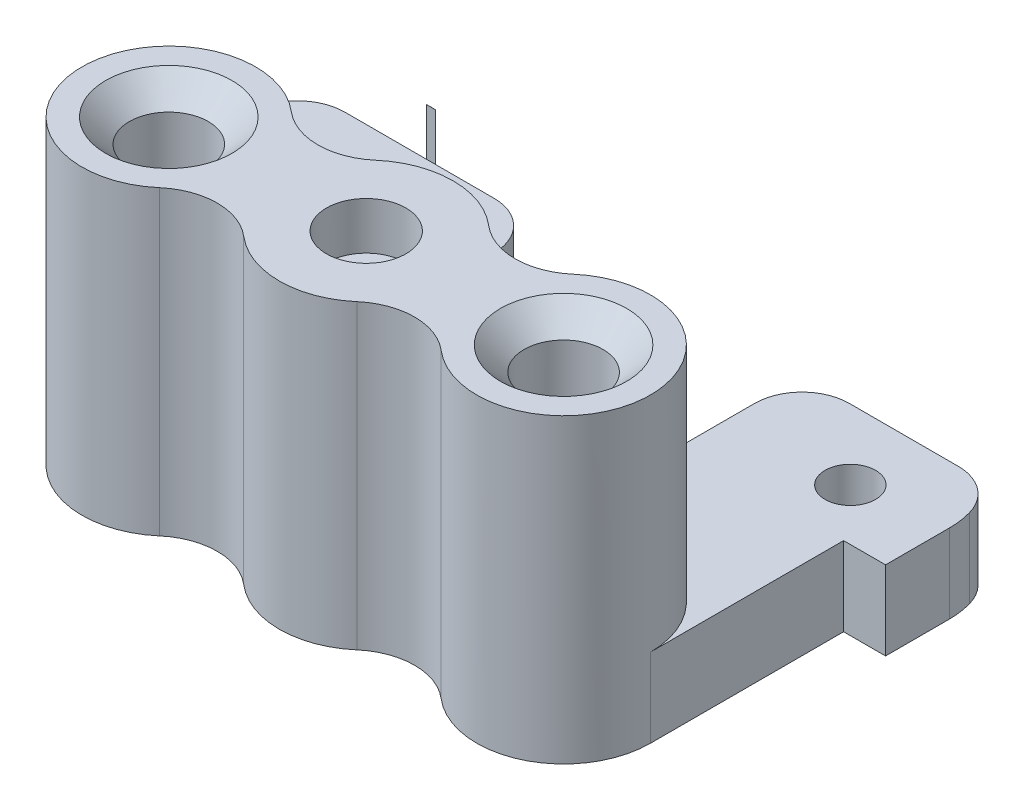
from build123d import *

# Parameters (mm, degrees)
BOSS_EXTRUDE1_DEPTH                              = 5
BOSS_EXTRUDE2_START                              = -5
BOSS_EXTRUDE2_DEPTH                              = 19.1
SKETCH3_W                                        = 13
SKETCH3_H                                        = 5
BOSS_EXTRUDE3_DEPTH                              = 9.535898385
CBORE_FOR_M3_HEX_HEAD_MACHINE_SCREW1_D           = 3.2
CBORE_FOR_M3_HEX_HEAD_MACHINE_SCREW1_DEPTH       = 19.1
CBORE_FOR_M3_HEX_HEAD_MACHINE_SCREW1_CBORE_D     = 7
CBORE_FOR_M3_HEX_HEAD_MACHINE_SCREW1_CBORE_DEPTH = 3
HOLE1_D                                          = 5.035
F_5_0_5_DIAMETER_HOLE1_D                         = 5
CHAMFER1_SIZE                                    = 1.5
FILLET3_R                                        = 5.5
SKETCH14_R                                       = 3.5
SKETCH14_R_2                                     = 1.6
BOSS_EXTRUDE6_DEPTH                              = 3
BOSS_EXTRUDE7_START                              = -16.1
SKETCH16_R                                       = 2.5175
BOSS_EXTRUDE7_DEPTH                              = 16.1
SKETCH17_W                                       = 42.998259914
SKETCH17_H                                       = 3
CUT_EXTRUDE1_DEPTH                               = 37.22236878
FILLET4_R                                        = 3


with BuildPart() as part:
    # Sketch1 → Boss-Extrude1 (new body)
    with BuildSketch(Plane.XZ):
        with BuildLine():
            Line((9.5, 3.268590611), (19.842867471, 3.268590611))
            Line((19.842867471, 3.268590611), (19.842867471, 15.5))
            ThreePointArc((19.842867471, 15.5), (16.640256161, 20.497199737), (10.762138304, 19.674730966))
            ThreePointArc((10.762138304, 19.674730966), (8.092867471, 18.68680314), (5.423596638, 19.674730966))
            ThreePointArc((5.423596638, 19.674730966), (1.842867471, 21), (-1.737861696, 19.674730966))
            ThreePointArc((-1.737861696, 19.674730966), (-4.407132529, 18.68680314), (-7.076403362, 19.674730966))
            ThreePointArc((-7.076403362, 19.674730966), (-12.052789143, 20.81997581), (-15.826095799, 17.379313363))
            Line((-15.826095799, 17.379313363), (-22.16896327, -0.066446146))
            ThreePointArc((-22.16896327, -0.066446146), (-21.421512658, -5.216879473), (-16.715069448, -7.438374058))
            Line((-16.715069448, -7.438374058), (-7, -7.438374058))
            Line((-7, -7.438374058), (-7, 3.552054318))
            ThreePointArc((-7, 3.552054318), (-7.195851886, 4.415216866), (-7.745049583, 5.1093274))
            ThreePointArc((-7.745049583, 5.1093274), (-8.412418376, 6.114614198), (-8.380071313, 7.320821609))
            Line((-8.380071313, 7.320821609), (-5.548817255, 15.5))
            Line((-5.548817255, 15.5), (11.5, 15.5))
            Line((11.5, 15.5), (11.5, 6.732692226))
            ThreePointArc((11.5, 6.732692226), (11.232050808, 5.732692226), (10.5, 5.000641419))
            ThreePointArc((10.5, 5.000641419), (9.767949192, 4.268590611), (9.5, 3.268590611))
        make_face()
    extrude(amount=-BOSS_EXTRUDE1_DEPTH)

    # Sketch2 → Boss-Extrude2 (add)
    with BuildSketch(Plane(origin=(0, 5, 0), x_dir=(-1, 0, 0), z_dir=(0, 1, 0)).offset(BOSS_EXTRUDE2_START)):
        with BuildLine():
            ThreePointArc((7.076403362, 11.325269034), (4.407132529, 12.31319686), (1.737861696, 11.325269034))
            ThreePointArc((1.737861696, 11.325269034), (-1.842867471, 10), (-5.423596638, 11.325269034))
            ThreePointArc((-5.423596638, 11.325269034), (-8.092867471, 12.31319686), (-10.762138304, 11.325269034))
            ThreePointArc((-10.762138304, 11.325269034), (-19.842867471, 15.5), (-10.762138304, 19.674730966))
            ThreePointArc((-10.762138304, 19.674730966), (-8.092867471, 18.68680314), (-5.423596638, 19.674730966))
            ThreePointArc((-5.423596638, 19.674730966), (-1.842867471, 21), (1.737861696, 19.674730966))
            ThreePointArc((1.737861696, 19.674730966), (4.407132529, 18.68680314), (7.076403362, 19.674730966))
            ThreePointArc((7.076403362, 19.674730966), (16.157132529, 15.5), (7.076403362, 11.325269034))
        make_face()
    extrude(amount=BOSS_EXTRUDE2_DEPTH)

    # Sketch3 → Boss-Extrude3 (add)
    with BuildSketch(Plane(origin=(0, 0, 3.268590611), x_dir=(-1, 0, 0), z_dir=(0, 0, -1))):
        with Locations((-16, 2.5)):
            Rectangle(SKETCH3_W, SKETCH3_H)
    extrude(amount=BOSS_EXTRUDE3_DEPTH)

    # CBORE for M3 Hex Head Machine Screw1
    with Locations(Plane(origin=(0, 0, 0), x_dir=(-1, 0, 0), z_dir=(0, -1, 0))):
        with Locations((17, 0), (-17, 0)):
            CounterBoreHole(CBORE_FOR_M3_HEX_HEAD_MACHINE_SCREW1_D / 2, CBORE_FOR_M3_HEX_HEAD_MACHINE_SCREW1_CBORE_D / 2, CBORE_FOR_M3_HEX_HEAD_MACHINE_SCREW1_CBORE_DEPTH, depth=CBORE_FOR_M3_HEX_HEAD_MACHINE_SCREW1_DEPTH)

    # Hole1 (through all)
    with Locations(Plane(origin=(0, 0, 0), x_dir=(-1, 0, 0), z_dir=(0, -1, 0))):
        with Locations((-1.842867471, -15.5)):
            Hole(HOLE1_D / 2)

    # Ø5.0 (5) Diameter Hole1 (through all)
    with Locations(Plane(origin=(0, 0, 0), x_dir=(-1, 0, 0), z_dir=(0, -1, 0))):
        with Locations((10.657132529, -15.5), (-14.342867471, -15.5)):
            Hole(F_5_0_5_DIAMETER_HOLE1_D / 2)

    # Chamfer1
    chamfer1_edges = [part.edges().sort_by_distance(p)[0] for p in [
        (-13.157132529, 19.1, 15.5),
        (11.842867471, 19.1, 15.5),
    ]]
    chamfer(chamfer1_edges, length=CHAMFER1_SIZE)

    # Fillet3
    fillet3_edges = [part.edges().sort_by_distance(p)[0] for p in [
        (22.5, 2.5, -6.267307774),
    ]]
    fillet(fillet3_edges, radius=FILLET3_R)

    # Sketch14 → Boss-Extrude6 (add)
    # profile 1 of 2: a face of its own
    with BuildSketch(Plane.XZ):
        with Locations((17, 0)):
            Circle(SKETCH14_R)
        with Locations(Location((17, 0, 0), (0, 0, 270))):
            Circle(SKETCH14_R_2, mode=Mode.SUBTRACT)
    # profile 2 of 2: a face of its own
    with BuildSketch(Plane.XZ):
        with Locations((-17, 0)):
            Circle(SKETCH14_R)
        with Locations(Location((-17, 0, 0), (0, 0, 270))):
            Circle(SKETCH14_R_2, mode=Mode.SUBTRACT)
    extrude(amount=-BOSS_EXTRUDE6_DEPTH)

    # Sketch16 → Boss-Extrude7 (add)
    with BuildSketch(Plane.XZ.offset(BOSS_EXTRUDE7_START)):
        with Locations(Location((1.842867471, 15.5, 0), (0, 0, 270))):
            Circle(SKETCH16_R)
    extrude(amount=BOSS_EXTRUDE7_DEPTH)

    # Sketch17 → Cut-Extrude1 (cut, through all)
    with BuildSketch(Plane.XZ):
        with Locations((-0.40361139, -5.938374058)):
            Rectangle(SKETCH17_W, SKETCH17_H)
    extrude(amount=-CUT_EXTRUDE1_DEPTH, mode=Mode.SUBTRACT)


with BuildPart() as cut_extrude1_piece_1:
    # of the separate pieces the step leaves, piece 1, a body of its own (cut_extrude1_pieces)
    add(part.part.solids().sort_by_distance((22.5, 0, -0.767307774))[0])

    # Fillet4
    fillet4_edges = [cut_extrude1_piece_1.edges().sort_by_distance(p)[0] for p in [
        (-21.902741347, 2.5, -4.438374058),
        (9.5, 2.5, -4.438374058),
        (21.095518567, 2.5, -4.438374058),
        (-7, 2.5, -4.438374058),
    ]]
    fillet(fillet4_edges, radius=FILLET4_R)


with BuildPart() as cut_extrude1_piece_2:
    # of the separate pieces the step leaves, piece 2, a body of its own (cut_extrude1_pieces)
    add(part.part.solids().sort_by_distance((-17.284930552, 0, -7.438374058))[0])


solid = Compound([cut_extrude1_piece_1.part, cut_extrude1_piece_2.part])
